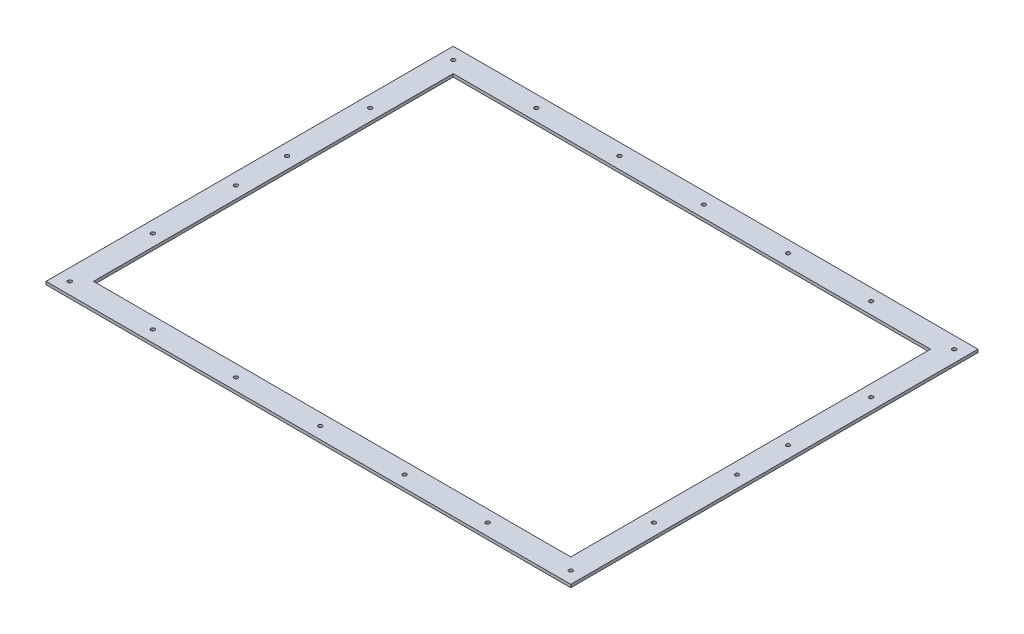
from build123d import *

# Parameters (mm, degrees)
SCHIZZO1_W                   = 884
SCHIZZO1_H                   = 686
SCHIZZO1_W_2                 = 804
SCHIZZO1_H_2                 = 606
ESTRUSIONE_ESTRUSIONE1_DEPTH = 2.5
SCHIZZO2_R                   = 3.25
TAGLIO_ESTRUSIONE1_DEPTH     = 560.497989273


with BuildPart() as part:
    # Schizzo1 → Estrusione-Estrusione1 (new, symmetric)
    with BuildSketch(Plane(origin=(0, 0, 0), x_dir=(1, 0, 0), z_dir=(0, 1, 0))):
        Rectangle(SCHIZZO1_W, SCHIZZO1_H)
        Rectangle(SCHIZZO1_W_2, SCHIZZO1_H_2, mode=Mode.SUBTRACT)
    extrude(amount=ESTRUSIONE_ESTRUSIONE1_DEPTH, both=True)

    # Schizzo2 → Taglio-Estrusione1 (cut, through all)
    with BuildSketch(Plane(origin=(0, 2.5, 0), x_dir=(1, 0, 0), z_dir=(0, 1, 0))):
        with Locations(Location((-422, 323, 0), (0, 0, 270))):
            Circle(SCHIZZO2_R)
        with Locations(Location((422, 323, 0), (0, 0, 90))):
            Circle(SCHIZZO2_R)
        with Locations(Location((422, -323, 0), (0, 0, 270))):
            Circle(SCHIZZO2_R)
        with Locations(Location((-422, -323, 0), (0, 0, 90))):
            Circle(SCHIZZO2_R)
        with Locations(Location((-282, 323, 0), (0, 0, 270))):
            Circle(SCHIZZO2_R)
        with Locations(Location((-142, 323, 0), (0, 0, 270))):
            Circle(SCHIZZO2_R)
        with Locations(Location((0, 323, 0), (0, 0, 270))):
            Circle(SCHIZZO2_R)
        with Locations(Location((142, 323, 0), (0, 0, 90))):
            Circle(SCHIZZO2_R)
        with Locations(Location((282, 323, 0), (0, 0, 90))):
            Circle(SCHIZZO2_R)
        with Locations(Location((282, -323, 0), (0, 0, 270))):
            Circle(SCHIZZO2_R)
        with Locations(Location((142, -323, 0), (0, 0, 270))):
            Circle(SCHIZZO2_R)
        with Locations(Location((0, -323, 0), (0, 0, 90))):
            Circle(SCHIZZO2_R)
        with Locations(Location((-142, -323, 0), (0, 0, 90))):
            Circle(SCHIZZO2_R)
        with Locations(Location((-282, -323, 0), (0, 0, 90))):
            Circle(SCHIZZO2_R)
        with Locations(Location((-422, 183, 0), (0, 0, 270))):
            Circle(SCHIZZO2_R)
        with Locations(Location((-422, 43, 0), (0, 0, 270))):
            Circle(SCHIZZO2_R)
        with Locations(Location((-422, -43, 0), (0, 0, 90))):
            Circle(SCHIZZO2_R)
        with Locations(Location((-422, -183, 0), (0, 0, 90))):
            Circle(SCHIZZO2_R)
        with Locations(Location((422, -183, 0), (0, 0, 270))):
            Circle(SCHIZZO2_R)
        with Locations(Location((422, -43, 0), (0, 0, 270))):
            Circle(SCHIZZO2_R)
        with Locations(Location((422, 43, 0), (0, 0, 90))):
            Circle(SCHIZZO2_R)
        with Locations(Location((422, 183, 0), (0, 0, 90))):
            Circle(SCHIZZO2_R)
    extrude(amount=-TAGLIO_ESTRUSIONE1_DEPTH, mode=Mode.SUBTRACT)


solid = part.part
